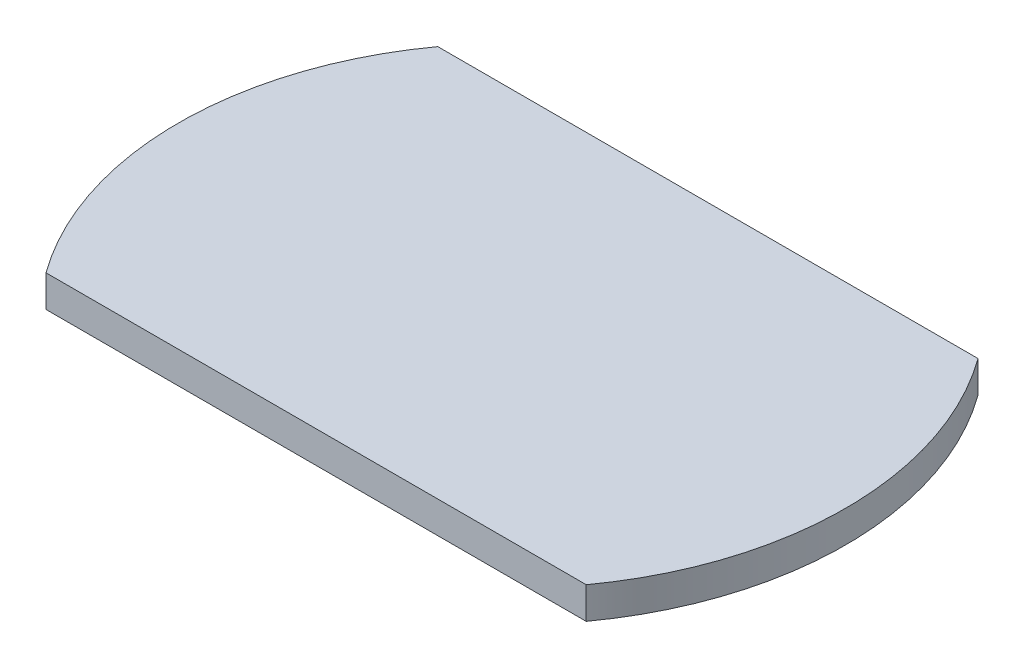
from build123d import *

# Parameters (mm, degrees)
BOSS_EXTRU_1_DEPTH = 10


with BuildPart() as part:
    # Esquisse2 → Boss.-Extru.1 (new body)
    with BuildSketch(Plane(origin=(0, 0, 0), x_dir=(1, 0, 0), z_dir=(0, 1, 0))):
        with BuildLine():
            Line((-85, -61.64414003), (85, -61.64414003))
            ThreePointArc((85, -61.64414003), (105, 0), (85, 61.64414003))
            Line((85, 61.64414003), (-85, 61.64414003))
            ThreePointArc((-85, 61.64414003), (-105, 0), (-85, -61.64414003))
        make_face()
    extrude(amount=BOSS_EXTRU_1_DEPTH)


solid = part.part
